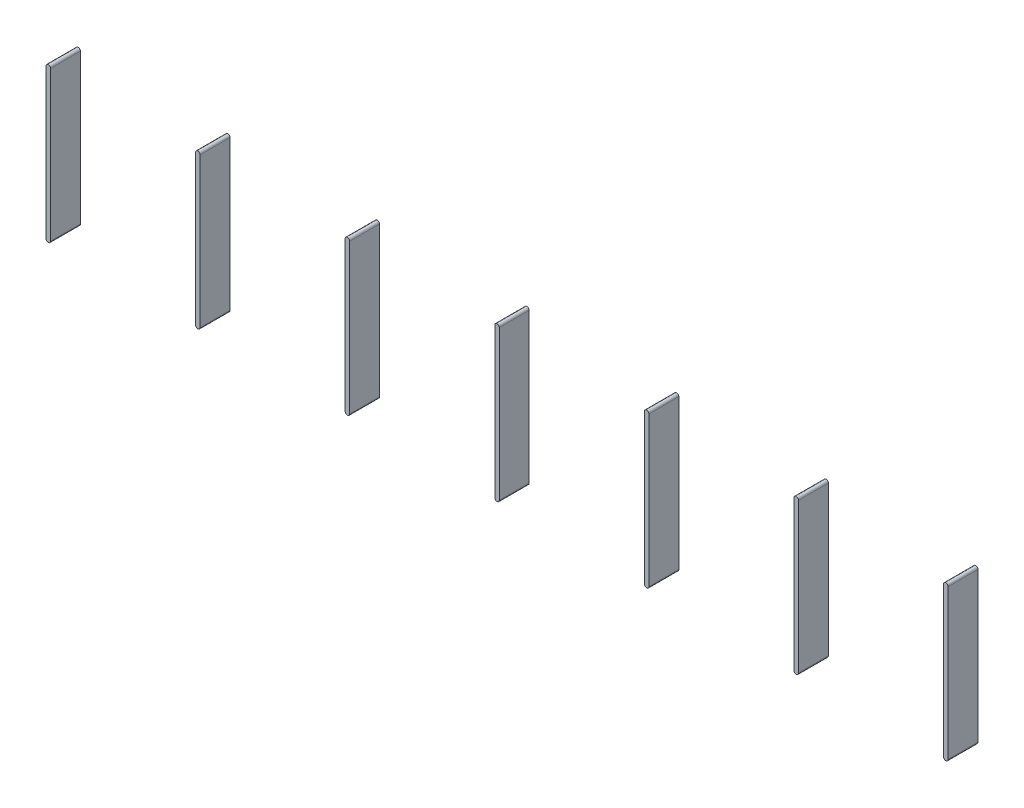
from build123d import *

# Parameters (mm, degrees)
BOSS_EXTRUDE1_DEPTH   = 4
BOSS_EXTRUDE1_2_DEPTH = 4
BOSS_EXTRUDE1_3_DEPTH = 4
BOSS_EXTRUDE1_4_DEPTH = 4
BOSS_EXTRUDE1_5_DEPTH = 4
BOSS_EXTRUDE1_6_DEPTH = 4
BOSS_EXTRUDE1_7_DEPTH = 4


with BuildPart() as part:
    # Sketch1 → Boss-Extrude1 (new body)
    with BuildSketch(Plane.XY):
        with BuildLine():
            Line((0.3, 0), (0.3, -20))
            ThreePointArc((0.3, -20), (0, -20.3), (-0.3, -20))
            Line((-0.3, -20), (-0.3, 0))
            ThreePointArc((-0.3, 0), (0, 0.3), (0.3, 0))
        make_face()
    extrude(amount=BOSS_EXTRUDE1_DEPTH)


with BuildPart() as body_2:
    # Sketch1 → Boss-Extrude1 2 (new body)
    with BuildSketch(Plane.XY):
        with BuildLine():
            Line((40.3, 0), (40.3, -20))
            ThreePointArc((40.3, -20), (40, -20.3), (39.7, -20))
            Line((39.7, -20), (39.7, 0))
            ThreePointArc((39.7, 0), (40, 0.3), (40.3, 0))
        make_face()
    extrude(amount=BOSS_EXTRUDE1_2_DEPTH)


with BuildPart() as body_3:
    # Sketch1 → Boss-Extrude1 3 (new body)
    with BuildSketch(Plane.XY):
        with BuildLine():
            Line((20.3, 0), (20.3, -20))
            ThreePointArc((20.3, -20), (20, -20.3), (19.7, -20))
            Line((19.7, -20), (19.7, 0))
            ThreePointArc((19.7, 0), (20, 0.3), (20.3, 0))
        make_face()
    extrude(amount=BOSS_EXTRUDE1_3_DEPTH)


with BuildPart() as body_4:
    # Sketch1 → Boss-Extrude1 4 (new body)
    with BuildSketch(Plane.XY):
        with BuildLine():
            Line((-19.7, 0), (-19.7, -20))
            ThreePointArc((-19.7, -20), (-20, -20.3), (-20.3, -20))
            Line((-20.3, -20), (-20.3, 0))
            ThreePointArc((-20.3, 0), (-20, 0.3), (-19.7, 0))
        make_face()
    extrude(amount=BOSS_EXTRUDE1_4_DEPTH)


with BuildPart() as body_5:
    # Sketch1 → Boss-Extrude1 5 (new body)
    with BuildSketch(Plane.XY):
        with BuildLine():
            Line((-39.7, 0), (-39.7, -20))
            ThreePointArc((-39.7, -20), (-40, -20.3), (-40.3, -20))
            Line((-40.3, -20), (-40.3, 0))
            ThreePointArc((-40.3, 0), (-40, 0.3), (-39.7, 0))
        make_face()
    extrude(amount=BOSS_EXTRUDE1_5_DEPTH)


with BuildPart() as body_6:
    # Sketch1 → Boss-Extrude1 6 (new body)
    with BuildSketch(Plane.XY):
        with BuildLine():
            Line((-59.7, 0), (-59.7, -20))
            ThreePointArc((-59.7, -20), (-60, -20.3), (-60.3, -20))
            Line((-60.3, -20), (-60.3, 0))
            ThreePointArc((-60.3, 0), (-60, 0.3), (-59.7, 0))
        make_face()
    extrude(amount=BOSS_EXTRUDE1_6_DEPTH)


with BuildPart() as body_7:
    # Sketch1 → Boss-Extrude1 7 (new body)
    with BuildSketch(Plane.XY):
        with BuildLine():
            Line((-79.7, 0), (-79.7, -20))
            ThreePointArc((-79.7, -20), (-80, -20.3), (-80.3, -20))
            Line((-80.3, -20), (-80.3, 0))
            ThreePointArc((-80.3, 0), (-80, 0.3), (-79.7, 0))
        make_face()
    extrude(amount=BOSS_EXTRUDE1_7_DEPTH)


solid = Compound([part.part, body_2.part, body_3.part, body_4.part, body_5.part, body_6.part, body_7.part])
